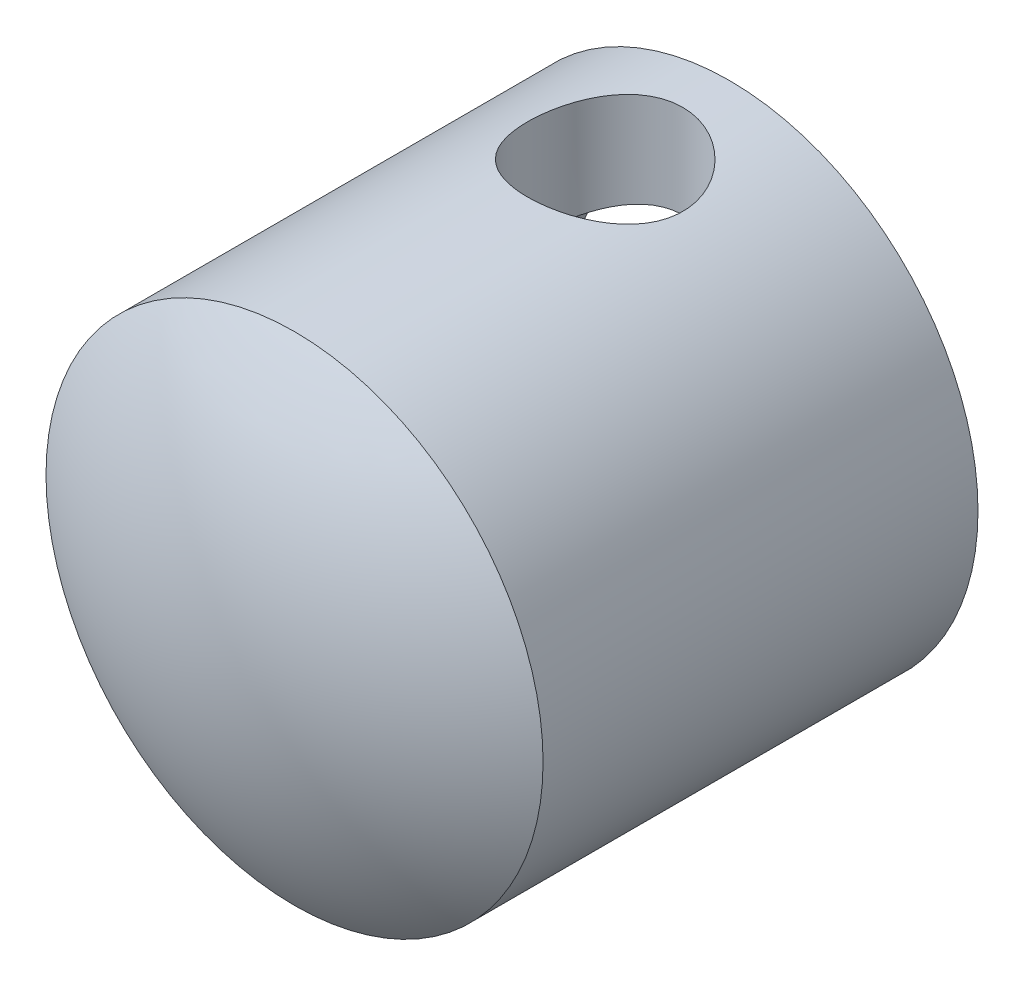
from build123d import *

# Parameters (mm, degrees)
ESQUISSE3_R             = 2.5
ENL_V_MAT_EXTRU_1_DEPTH = 10


with BuildPart() as part:
    # Esquisse2 → Base-Révolution (revolve)
    with BuildSketch(Plane(origin=(0, 0, 0), x_dir=(0, 0, -1), z_dir=(1, 0, 0))):
        with BuildLine():
            Line((-63.5, 5), (-73.5, 5))
            Line((-73.5, 5), (-73.5, 4))
            Line((-73.5, 4), (-74.5, 4))
            Line((-74.5, 4), (-77.41039886, 0))
            Line((-77.41039886, 0), (-80.010874707, 0))
            ThreePointArc((-80.010874707, 0), (-79.368414789, 4.192388692), (-77.5, 8))
            Line((-77.5, 8), (-63.5, 8))
            Line((-63.5, 8), (-63.5, 5))
        make_face()
    revolve(axis=Axis((0, 0, 0), (0, 0, 1)))

    # Esquisse3 → Enlèv. mat.-Extru.1 (cut, symmetric)
    with BuildSketch(Plane(origin=(0, 0, 0), x_dir=(1, 0, 0), z_dir=(0, 1, 0))):
        with Locations((0, -67.5)):
            Circle(ESQUISSE3_R)
    extrude(amount=ENL_V_MAT_EXTRU_1_DEPTH, both=True, mode=Mode.SUBTRACT)


solid = part.part
